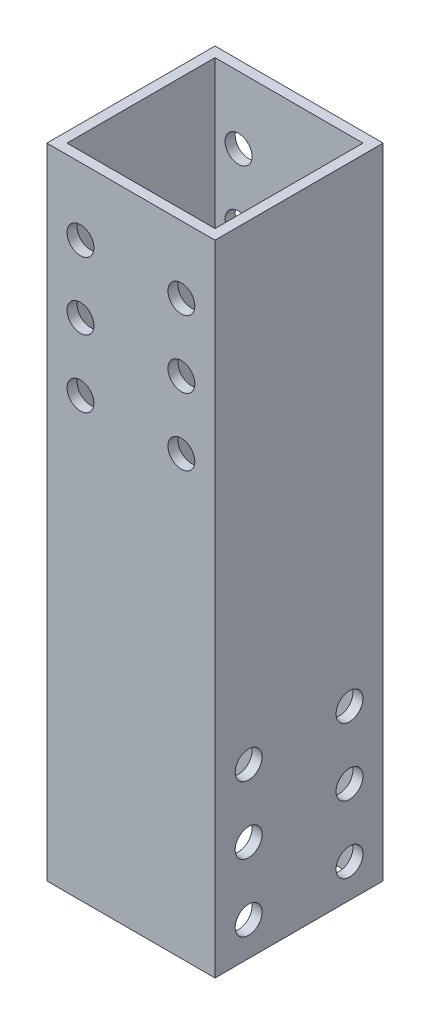
from build123d import *

# Parameters (mm, degrees)
BOSS_EXTRUDE1_DEPTH      = 47.5
BOSS_EXTRUDE1_DEPTH_BACK = 47.5
SKETCH3_W                = 25
SKETCH3_H                = 25
SKETCH3_W_2              = 22
SKETCH3_H_2              = 22
SKETCH6_R                = 2
CUT_EXTRUDE3_DEPTH       = 25
SKETCH7_R                = 2
CUT_EXTRUDE4_DEPTH       = 25


with BuildPart() as part:
    # Sketch3 → Boss-Extrude1 (new, two sides: drawn at the far end of the back side and taken through both)
    with BuildSketch(Plane(origin=(0, 0, 0), x_dir=(1, 0, 0), z_dir=(0, 1, 0)).offset(-BOSS_EXTRUDE1_DEPTH_BACK)):
        Rectangle(SKETCH3_W, SKETCH3_H)
        Rectangle(SKETCH3_W_2, SKETCH3_H_2, mode=Mode.SUBTRACT)
    extrude(amount=BOSS_EXTRUDE1_DEPTH + BOSS_EXTRUDE1_DEPTH_BACK)

    # Sketch6 → Cut-Extrude3 (cut)
    with BuildSketch(Plane(origin=(12.5, 0, 0), x_dir=(0, 0, -1), z_dir=(1, 0, 0))):
        with Locations((7.5, -42.5)):
            Circle(SKETCH6_R)
        with Locations((7.5, -22.5)):
            Circle(SKETCH6_R)
        with Locations((-7.5, -42.5)):
            Circle(SKETCH6_R)
        with Locations((-7.5, -22.5)):
            Circle(SKETCH6_R)
        with Locations((7.5, -32.5)):
            Circle(SKETCH6_R)
        with Locations((-7.5, -32.5)):
            Circle(SKETCH6_R)
    extrude(amount=-CUT_EXTRUDE3_DEPTH, mode=Mode.SUBTRACT)

    # Sketch7 → Cut-Extrude4 (cut)
    with BuildSketch(Plane(origin=(0, 0, -12.5), x_dir=(-1, 0, 0), z_dir=(0, 0, -1))):
        with Locations((7.5, 37.5)):
            Circle(SKETCH7_R)
        with Locations((7.5, 27.5)):
            Circle(SKETCH7_R)
        with Locations((-7.5, 37.5)):
            Circle(SKETCH7_R)
        with Locations((-7.5, 27.5)):
            Circle(SKETCH7_R)
        with Locations((-7.5, 17.5)):
            Circle(SKETCH7_R)
        with Locations((7.5, 17.5)):
            Circle(SKETCH7_R)
    extrude(amount=-CUT_EXTRUDE4_DEPTH, mode=Mode.SUBTRACT)


solid = part.part
